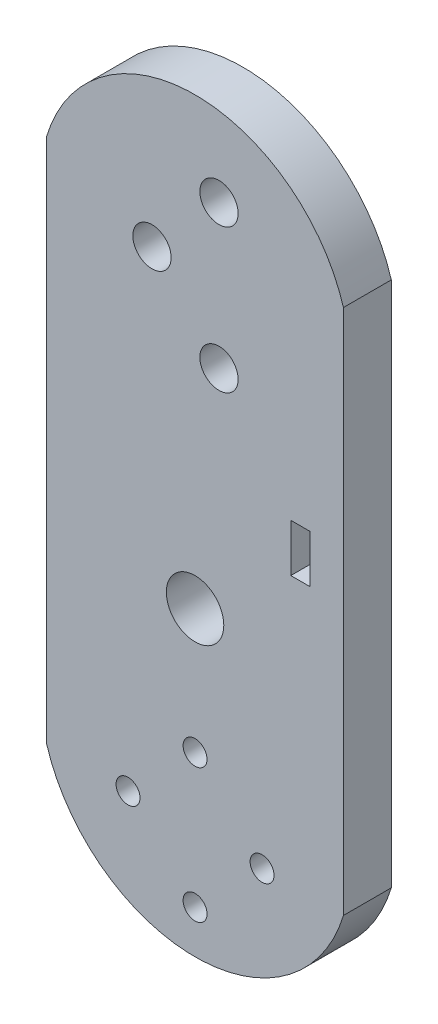
from build123d import *

# Parameters (mm, degrees)
SKETCH1_R           = 1.25
SKETCH1_R_2         = 3
SKETCH1_R_3         = 2
SKETCH1_W           = 2
SKETCH1_H           = 5
BOSS_EXTRUDE1_DEPTH = 5


with BuildPart() as part:
    # Sketch1 → Boss-Extrude1 (new body)
    with BuildSketch(Plane.XY):
        with BuildLine():
            Line((-15.5, 55), (-15.5, 0))
            ThreePointArc((-15.5, 0), (0, -11.5), (15.5, 0))
            Line((15.5, 0), (15.5, 55))
            ThreePointArc((15.5, 55), (0, 66.5), (-15.5, 55))
        make_face()
        with Locations((0, 7)):
            Circle(SKETCH1_R, mode=Mode.SUBTRACT)
        with Locations((7, 0)):
            Circle(SKETCH1_R, mode=Mode.SUBTRACT)
        with Locations((0, -7)):
            Circle(SKETCH1_R, mode=Mode.SUBTRACT)
        with Locations((-7, 0)):
            Circle(SKETCH1_R, mode=Mode.SUBTRACT)
        with Locations((0, 20)):
            Circle(SKETCH1_R_2, mode=Mode.SUBTRACT)
        with Locations((2.5, 58)):
            Circle(SKETCH1_R_3, mode=Mode.SUBTRACT)
        with Locations((2.5, 43)):
            Circle(SKETCH1_R_3, mode=Mode.SUBTRACT)
        with Locations((-4.5, 50.5)):
            Circle(SKETCH1_R_3, mode=Mode.SUBTRACT)
        with Locations((11, 30.5)):
            Rectangle(SKETCH1_W, SKETCH1_H, mode=Mode.SUBTRACT)
    extrude(amount=BOSS_EXTRUDE1_DEPTH)


solid = part.part
